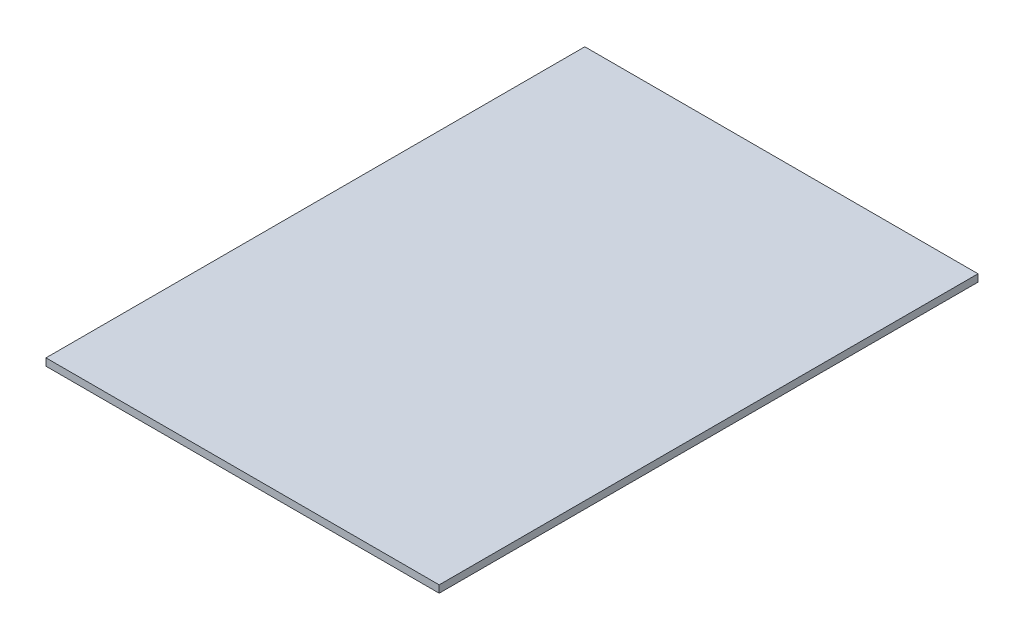
from build123d import *

# Parameters (mm, degrees)
SKETCH1_W           = 270
SKETCH1_H           = 370
BOSS_EXTRUDE1_DEPTH = 5


with BuildPart() as part:
    # Sketch1 → Boss-Extrude1 (new body)
    with BuildSketch(Plane(origin=(0, 0, 0), x_dir=(1, 0, 0), z_dir=(0, 1, 0))):
        with Locations((135, 185)):
            Rectangle(SKETCH1_W, SKETCH1_H)
    extrude(amount=BOSS_EXTRUDE1_DEPTH)


solid = part.part
